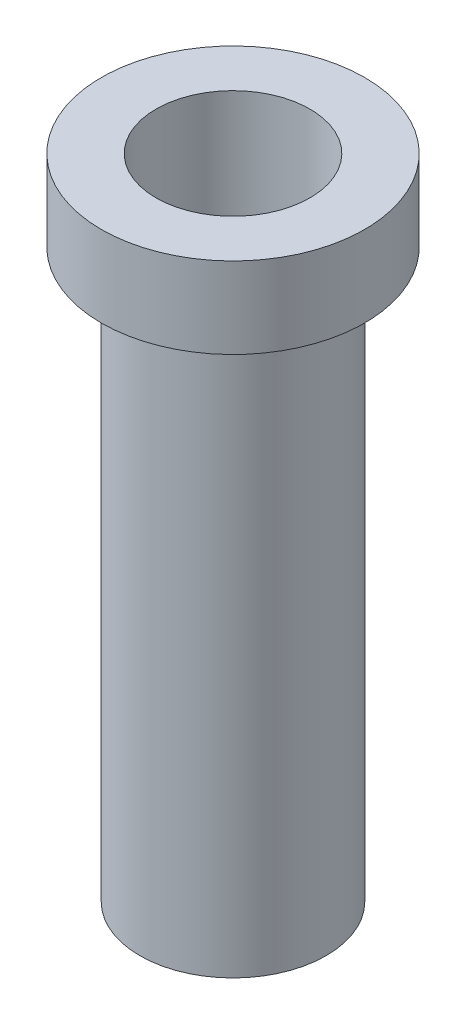
from build123d import *

# Parameters (mm, degrees)
SKETCH1_R           = 3.25
BOSS_EXTRUDE1_DEPTH = 2
SKETCH2_R           = 2.3
BOSS_EXTRUDE2_DEPTH = 14
SKETCH4_R           = 1.9
CUT_EXTRUDE1_DEPTH  = 17.647071815


with BuildPart() as part:
    # Sketch1 → Boss-Extrude1 (new body)
    with BuildSketch(Plane(origin=(0, 0, 0), x_dir=(1, 0, 0), z_dir=(0, 1, 0))):
        with Locations(Location((0, 0, 0), (0, 0, 270))):
            Circle(SKETCH1_R)
    extrude(amount=BOSS_EXTRUDE1_DEPTH)

    # Sketch2 → Boss-Extrude2 (add)
    with BuildSketch(Plane(origin=(0, 0, 0), x_dir=(-1, 0, 0), z_dir=(0, -1, 0))):
        with Locations(Location((0, 0, 0), (0, 0, 90))):
            Circle(SKETCH2_R)
    extrude(amount=BOSS_EXTRUDE2_DEPTH)

    # Sketch4 → Cut-Extrude1 (cut, through all)
    with BuildSketch(Plane(origin=(0, 2, 0), x_dir=(1, 0, 0), z_dir=(0, 1, 0))):
        with Locations(Location((0, 0, 0), (0, 0, 270))):
            Circle(SKETCH4_R)
    extrude(amount=-CUT_EXTRUDE1_DEPTH, mode=Mode.SUBTRACT)


solid = part.part
